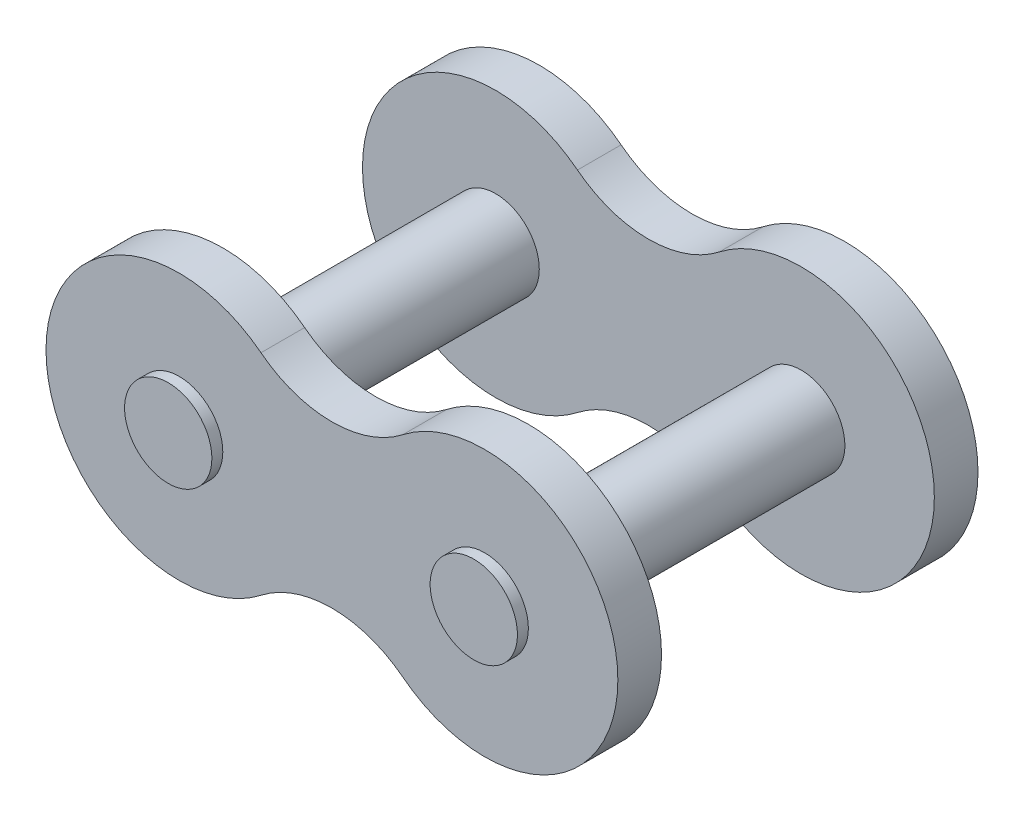
from build123d import *

# Parameters (mm, degrees)
CROQUIS1_R                   = 2
SALIENTE_EXTRUIR1_DEPTH      = 2
SALIENTE_EXTRUIR2_DEPTH      = 15
SALIENTE_EXTRUIR2_DEPTH_BACK = 2.5
CROQUIS2_R                   = 2


with BuildPart() as part:
    # Croquis1 → Saliente-Extruir1 (new body)
    with BuildSketch(Plane.XY):
        with BuildLine():
            ThreePointArc((-3.250445743, 4.811532279), (-13.1, 0), (-3.250445743, -4.811532279))
            ThreePointArc((-3.250445743, -4.811532279), (0, -3.694574334), (3.250445743, -4.811532279))
            ThreePointArc((3.250445743, -4.811532279), (13.1, 0), (3.250445743, 4.811532279))
            ThreePointArc((3.250445743, 4.811532279), (0, 3.694574334), (-3.250445743, 4.811532279))
        make_face()
        with Locations((-7, 0)):
            Circle(CROQUIS1_R, mode=Mode.SUBTRACT)
        with Locations(Location((7, 0, 0), (0, 0, 180))):
            Circle(CROQUIS1_R, mode=Mode.SUBTRACT)
    saliente_extruir1 = extrude(amount=SALIENTE_EXTRUIR1_DEPTH)

    # Croquis2 → Saliente-Extruir2 (add, two sides: drawn at the far end of the back side and taken through both)
    with BuildSketch(Plane.XY.offset(2).offset(-SALIENTE_EXTRUIR2_DEPTH_BACK)):
        with Locations((7, 0)):
            Circle(CROQUIS2_R)
        with Locations((-7, 0)):
            Circle(CROQUIS2_R)
    extrude(amount=SALIENTE_EXTRUIR2_DEPTH + SALIENTE_EXTRUIR2_DEPTH_BACK)

    # Simetría1: Saliente-Extruir1 across plane
    add(saliente_extruir1.mirror(Plane.XY.offset(8.25)))


solid = part.part
